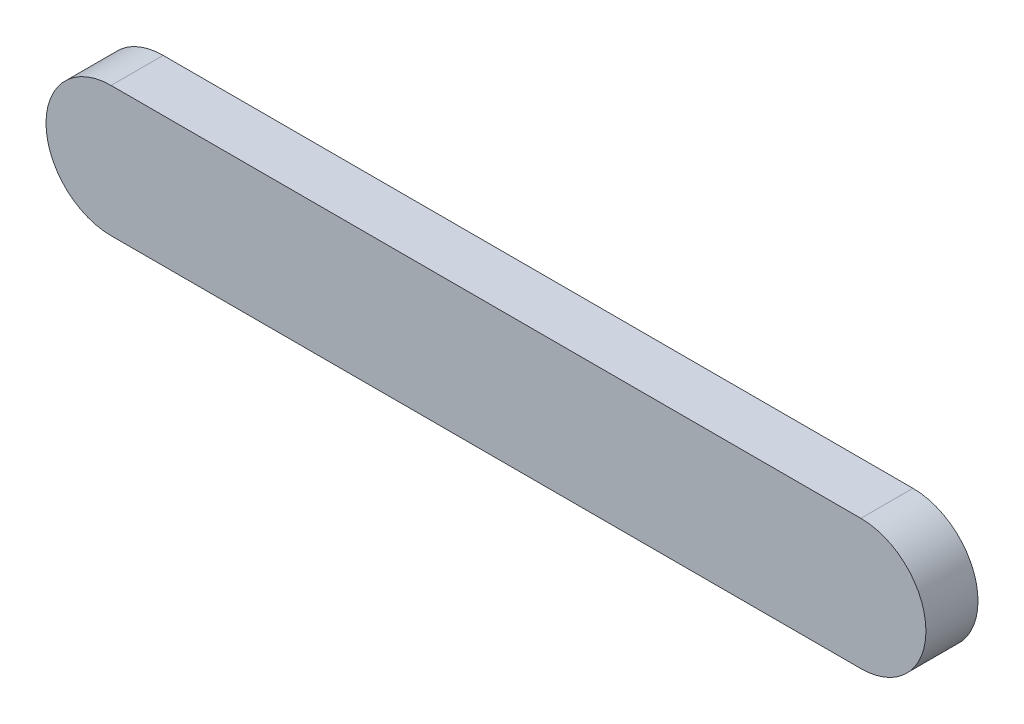
from build123d import *

# Parameters (mm, degrees)
EXTRUDE_1_DEPTH = 20


with BuildPart() as part:
    # 草图1 → 凸台-拉伸1 (new body)
    with BuildSketch(Plane.XY):
        with BuildLine():
            Line((0, 25), (288, 25))
            ThreePointArc((288, 25), (313, 0), (288, -25))
            Line((288, -25), (0, -25))
            ThreePointArc((0, -25), (-25, 0), (0, 25))
        make_face()
    extrude(amount=EXTRUDE_1_DEPTH)


solid = part.part
